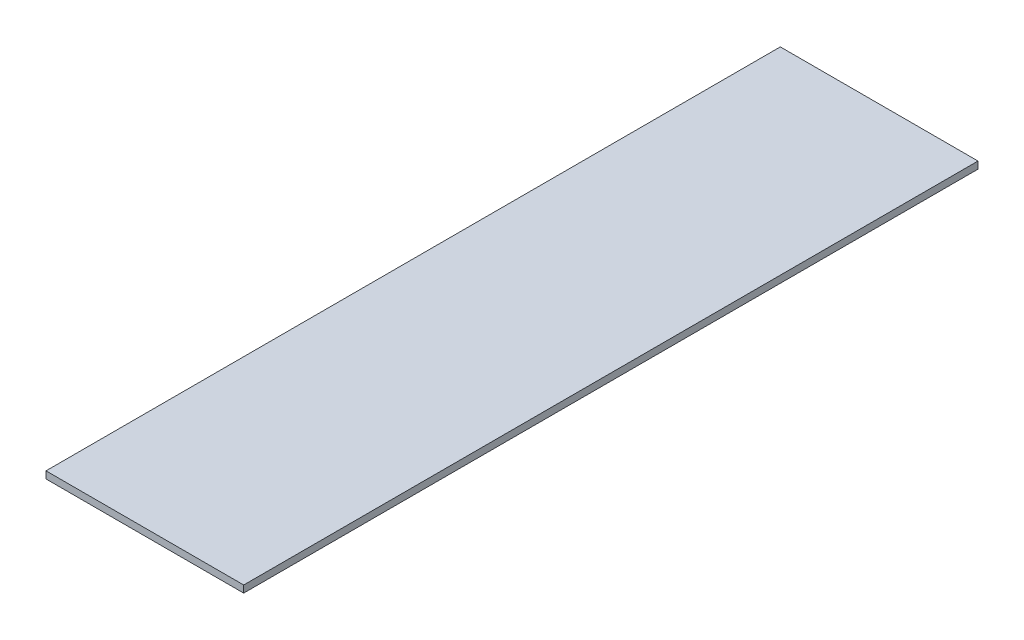
from build123d import *

# Parameters (mm, degrees)
SKETCH1_W        = 177.8
SKETCH1_H        = 660.4
EXTRUSION1_DEPTH = 6.35


with BuildPart() as part:
    # Sketch1 → Extrusion1 (new body)
    with BuildSketch(Plane(origin=(0, 0, 0), x_dir=(-1, 0, 0), z_dir=(0, 1, 0))):
        Rectangle(SKETCH1_W, SKETCH1_H)
    extrude(amount=EXTRUSION1_DEPTH)


solid = part.part
